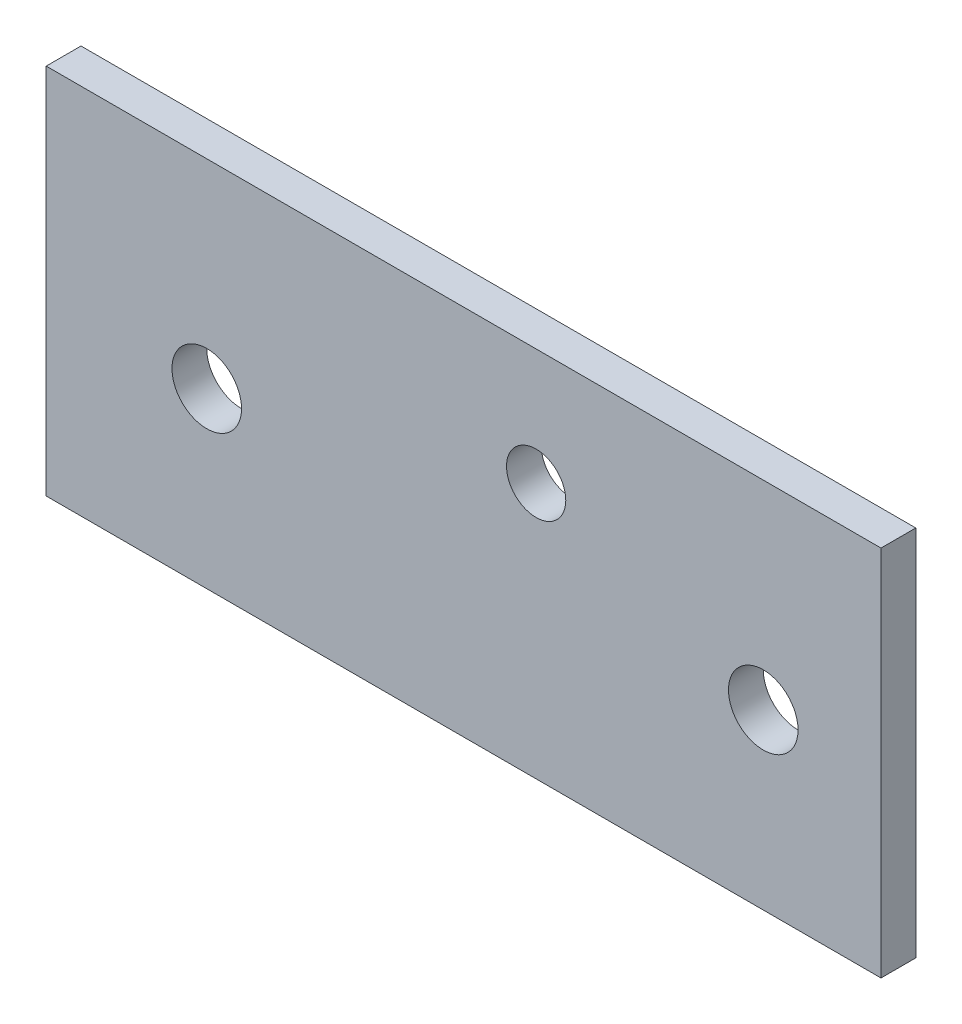
from build123d import *

# Parameters (mm, degrees)
SKETCH1_W               = 76.2
SKETCH1_H               = 33.988990963
SKETCH1_R               = 3.175
BOSS_EXTRUDE1_DEPTH     = 3.175
F_1_4_28_TAPPED_HOLE1_D = 5.4102


with BuildPart() as part:
    # Sketch1 → Boss-Extrude1 (new body)
    with BuildSketch(Plane.XY):
        with Locations((48.846994999, -293.647910147)):
            Rectangle(SKETCH1_W, SKETCH1_H)
        with Locations((25.4, -294.821428571)):
            Circle(SKETCH1_R, mode=Mode.SUBTRACT)
        with Locations((76.2, -294.821428571)):
            Circle(SKETCH1_R, mode=Mode.SUBTRACT)
    extrude(amount=BOSS_EXTRUDE1_DEPTH)

    # 1/4-28 Tapped Hole1 (through all)
    with Locations(Plane.XY.offset(3.175)):
        with Locations((55.4677219, -287.273383219)):
            Hole(F_1_4_28_TAPPED_HOLE1_D / 2)


solid = part.part
